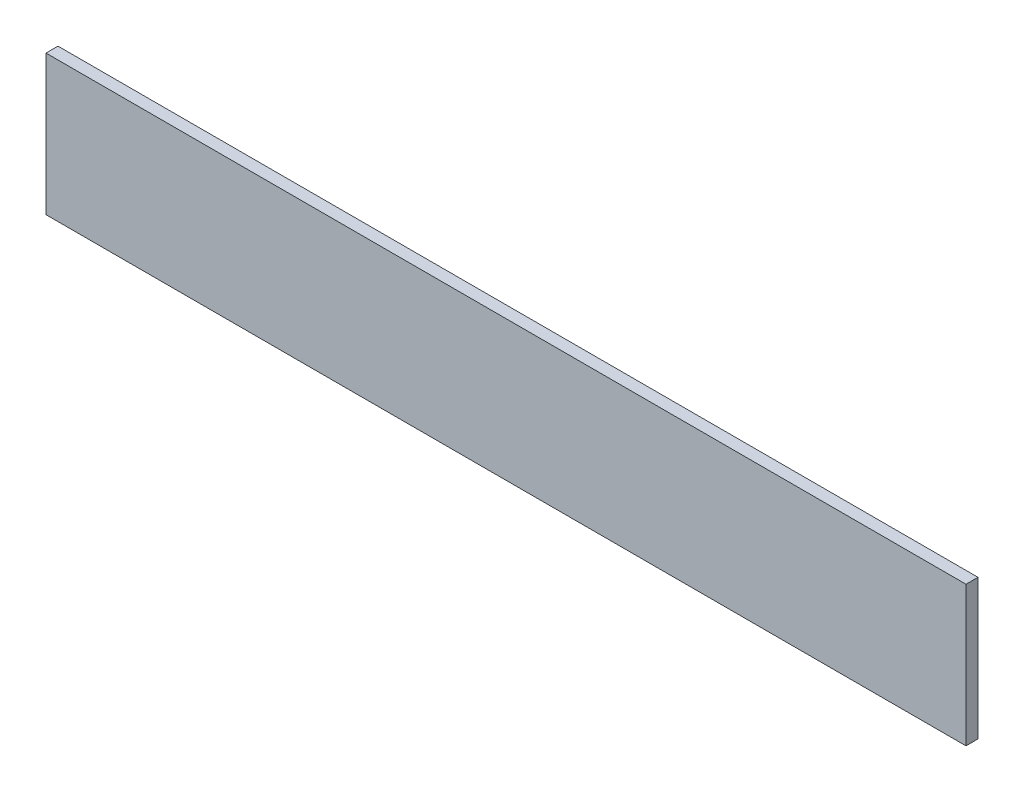
from build123d import *

# Parameters (mm, degrees)
SKETCH1_W           = 230
SKETCH1_H           = 35
BOSS_EXTRUDE1_DEPTH = 3


with BuildPart() as part:
    # Sketch1 → Boss-Extrude1 (new body)
    with BuildSketch(Plane.XY):
        Rectangle(SKETCH1_W, SKETCH1_H)
    extrude(amount=BOSS_EXTRUDE1_DEPTH)


solid = part.part
